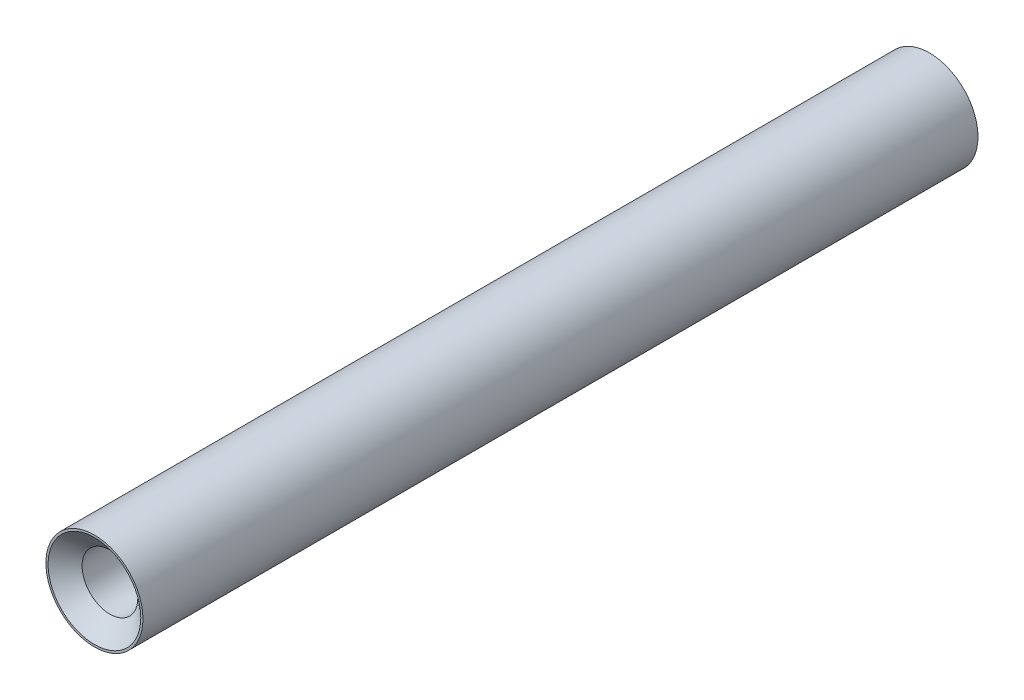
from build123d import *

# Parameters (mm, degrees)
SKETCH1_R           = 2.5
BOSS_EXTRUDE1_DEPTH = 43.02


with BuildPart() as part:
    # Sketch1 → Boss-Extrude1 (new body)
    with BuildSketch(Plane.XY):
        Circle(SKETCH1_R)
    extrude(amount=BOSS_EXTRUDE1_DEPTH)

    # Sketch3 → #6-40 Tapped Hole1 (revolve, cut)
    with BuildSketch(Plane(origin=(0, 0, 43.02), x_dir=(0, -1, 0), z_dir=(1, 0, 0))):
        Polygon((0, 0), (0, 9.782295074), (1.4351, 8.92), (1.4351, 0.799242399), (2.3876, 0), align=None)
    f_6_40_tapped_hole1 = revolve(axis=Axis((0, 0, 49.37), (0, 0, -1)), mode=Mode.SUBTRACT)

    # Mirror1: #6-40 Tapped Hole1 across plane
    add(f_6_40_tapped_hole1.mirror(Plane.XY.offset(21.51)), mode=Mode.SUBTRACT)


solid = part.part
